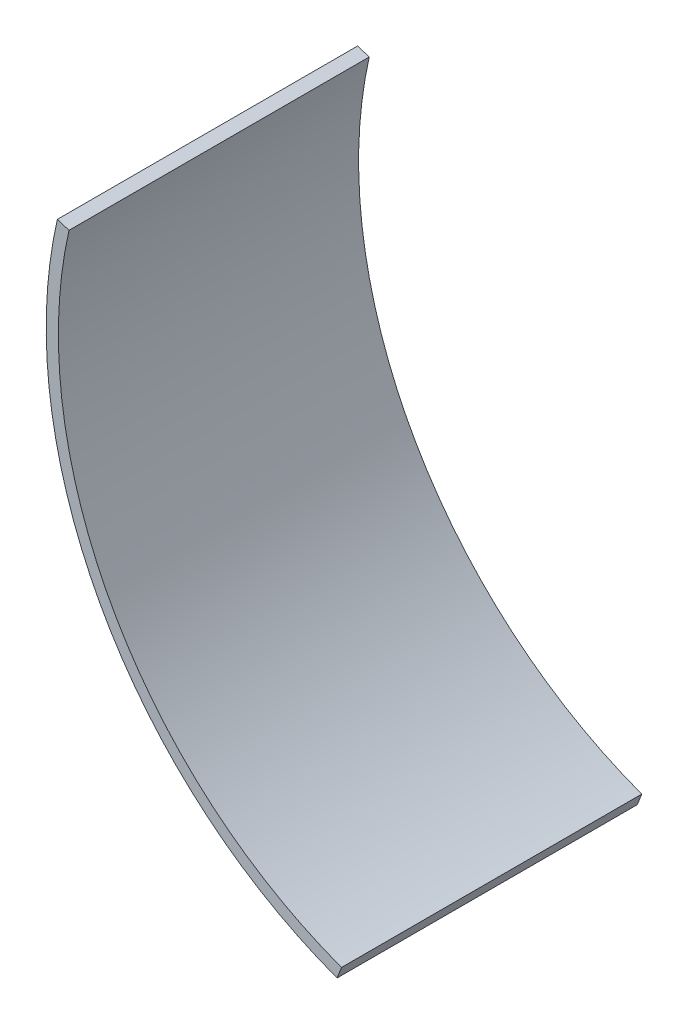
from build123d import *

# Parameters (mm, degrees)
Y_KSEKLIK_EKSTR_ZYON1_DEPTH = 370


with BuildPart() as part:
    # Model → Yükseklik-Ekstrüzyon1 (new body)
    with BuildSketch(Plane.XY):
        with BuildLine():
            ThreePointArc((2707.809953619, 1930.413382125), (2760.236519974, 1546.882218038), (3052.559283903, 1293.126232147))
            Line((3052.559283903, 1293.126232147), (3057.997199689, 1307.107962051))
            ThreePointArc((3057.997199689, 1307.107962051), (2773.778742407, 1553.375276393), (2722.163894248, 1925.885180989))
            Line((2722.163894248, 1925.885180989), (2707.809953619, 1930.413382126))
        make_face()
    extrude(amount=Y_KSEKLIK_EKSTR_ZYON1_DEPTH)


solid = part.part
